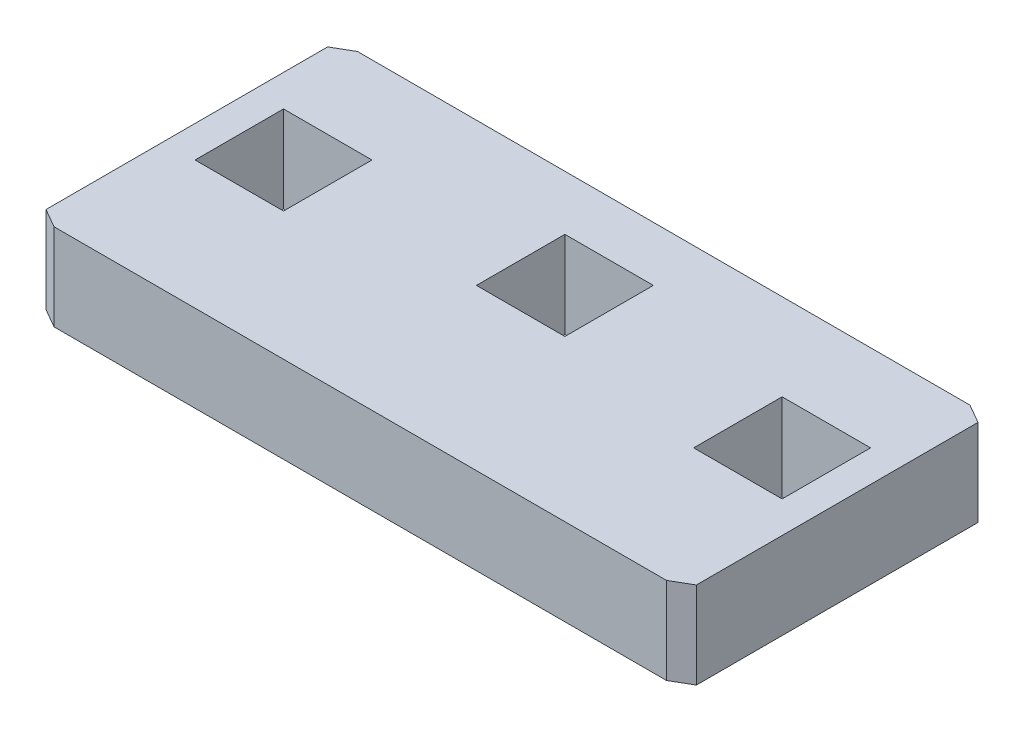
from build123d import *

# Parameters (mm, degrees)
SKETCH2_W      = 150
SKETCH2_H      = 70
EXTRUDE1_DEPTH = 20
SKETCH3_W      = 20.4
SKETCH3_H      = 20.4
EXTRUDE2_DEPTH = 20
SKETCH6_W      = 20.4
SKETCH6_H      = 20.4
EXTRUDE5_DEPTH = 20
EXTRUDE6_DEPTH = 20


with BuildPart() as part:
    # Sketch2 → Extrude1 (new body)
    with BuildSketch(Plane(origin=(0, 0, 0), x_dir=(1, 0, 0), z_dir=(0, 1, 0))):
        Rectangle(SKETCH2_W, SKETCH2_H)
    extrude(amount=EXTRUDE1_DEPTH)

    # Sketch3 → Extrude2 (cut)
    with BuildSketch(Plane(origin=(0, 20, 0), x_dir=(1, 0, 0), z_dir=(0, 1, 0))):
        with Locations((0, 12.2)):
            Rectangle(SKETCH3_W, SKETCH3_H)
    extrude(amount=-EXTRUDE2_DEPTH, mode=Mode.SUBTRACT)

    # Sketch6 → Extrude5 (cut)
    with BuildSketch(Plane(origin=(0, 20, 0), x_dir=(1, 0, 0), z_dir=(0, 1, 0))):
        with Locations((-57.5, 4.8)):
            Rectangle(SKETCH6_W, SKETCH6_H)
        with Locations((57.5, 4.8)):
            Rectangle(SKETCH6_W, SKETCH6_H)
    extrude(amount=-EXTRUDE5_DEPTH, mode=Mode.SUBTRACT)

    # Sketch7 → Extrude6 (cut)
    with BuildSketch(Plane(origin=(0, 20, 0), x_dir=(1, 0, 0), z_dir=(0, 1, 0))):
        Polygon((-70.635231965, -35), (-75, -32.48), (-75, -35), align=None)
        Polygon((-75, 35), (-70.635231965, 35), (-75, 32.48), align=None)
        Polygon((75, -35), (70.635231965, -35), (75, -32.48), align=None)
        Polygon((70.635231965, 35), (75, 32.48), (75, 35), align=None)
    extrude(amount=-EXTRUDE6_DEPTH, mode=Mode.SUBTRACT)


solid = part.part
